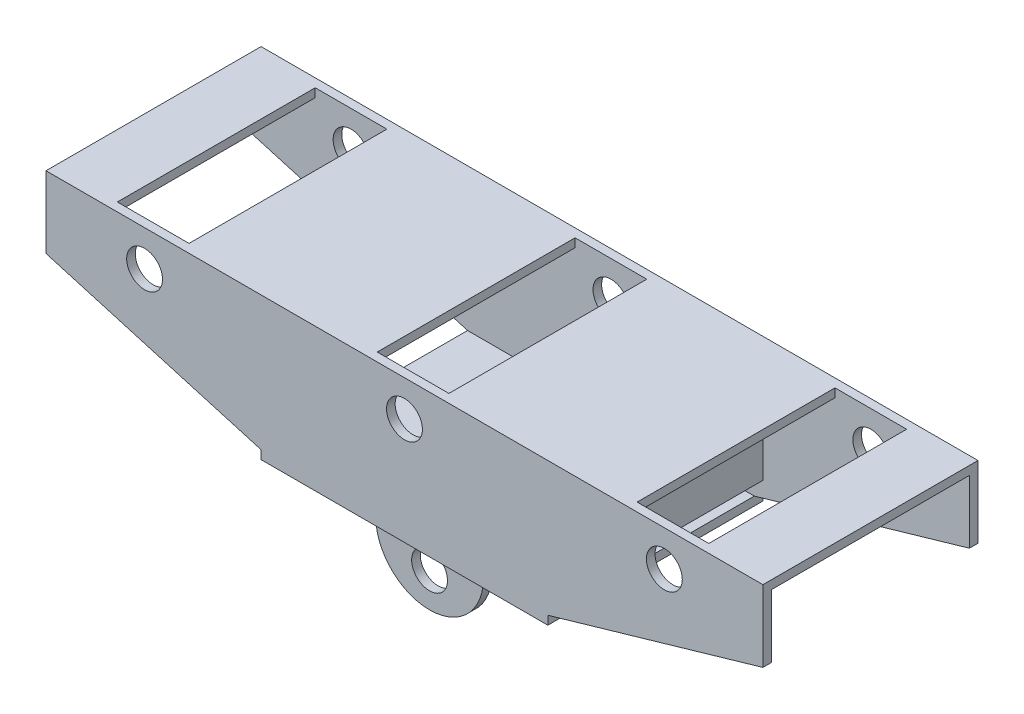
from build123d import *

# Parameters (mm, degrees)
EXTRUDE_1_DEPTH        = 276
EXTRUDE_1_2_DEPTH      = 276
EXTRUDE_2_DEPTH        = 12
PATTERN_LINEAR_1_COUNT = 2
PATTERN_LINEAR_1_PITCH = 288
SKETCH_3_W             = 276
SKETCH_3_H             = 12
EXTRUDE_3_DEPTH        = 1000
SKETCH_4_W             = 400
SKETCH_4_H             = 300
EXTRUDE_4_DEPTH        = 12
SKETCH_5_W             = 150
SKETCH_5_H             = 12
EXTRUDE_5_DEPTH        = 100
SKETCH_6_R             = 25
CUT_EXTRUDE_1_DEPTH    = 635.502955076
SKETCH_7_R             = 25
CUT_EXTRUDE_2_DEPTH    = 650.458235763
SKETCH_8_W             = 100
SKETCH_8_H             = 276
CUT_EXTRUDE_3_DEPTH    = 645.003105583


with BuildPart() as part:
    # 草图1 → 凸台-拉伸1 (new body)
    with BuildSketch(Plane.XY):
        Polygon((-300, 0), (-200, 0), (-200, -150), (-212, -150), (-212, -12), (-300, -12), align=None)
    extrude(amount=EXTRUDE_1_DEPTH)



with BuildPart() as body_2:
    # 草图1 → Extrude 1 2 (new body)
    with BuildSketch(Plane.XY):
        Polygon((300, 0), (200, 0), (200, -150), (212, -150), (212, -12), (300, -12), align=None)
    extrude(amount=EXTRUDE_1_2_DEPTH)


with BuildPart() as part_1:
    add(part.part)

    add(body_2.part)  # 凸台-拉伸2 merges body 2
    # 草图2 → 凸台-拉伸2 (add)
    with BuildSketch(Plane.XY.offset(276)):
        Polygon((-500, 12), (500, 12), (500, -88), (200, -175), (-200, -175), (-500, -88), align=None)
    extrude_2 = extrude(amount=EXTRUDE_2_DEPTH)

    # 阵列(线性)1: 凸台-拉伸2 ×2
    with Locations(*[(0, 0, -i * PATTERN_LINEAR_1_PITCH) for i in range(1, PATTERN_LINEAR_1_COUNT)]):
        add(extrude_2)

    # 草图3 → 凸台-拉伸3 (add)
    with BuildSketch(Plane(origin=(500, 0, 0), x_dir=(0, 0, -1), z_dir=(1, 0, 0))):
        with Locations((-138, 6)):
            Rectangle(SKETCH_3_W, SKETCH_3_H)
    extrude(amount=-EXTRUDE_3_DEPTH)

    # 草图4 → 凸台-拉伸4 (add)
    with BuildSketch(Plane.XZ.offset(175)):
        with Locations((0, 138)):
            Rectangle(SKETCH_4_W, SKETCH_4_H)
    extrude(amount=EXTRUDE_4_DEPTH)

    # 草图5 → 凸台-拉伸5 (add)
    with BuildSketch(Plane(origin=(0, -187, 0), x_dir=(-1, 0, 0), z_dir=(0, -1, 0))):
        with Locations((0, -247)):
            Rectangle(SKETCH_5_W, SKETCH_5_H)
        with Locations((0, -29)):
            Rectangle(SKETCH_5_W, SKETCH_5_H)
    extrude(amount=EXTRUDE_5_DEPTH)

    # 草图6 → 切除-拉伸1 (cut, through all)
    with BuildSketch(Plane.XY.offset(253)):
        with Locations((0, -238)):
            Circle(SKETCH_6_R)
        with BuildLine():
            Line((75, -211), (75, -287))
            Line((75, -287), (-75, -287))
            Line((-75, -287), (-75, -211))
            ThreePointArc((-75, -211), (0, -286), (75, -211))
        make_face()
    extrude(amount=-CUT_EXTRUDE_1_DEPTH, mode=Mode.SUBTRACT)

    # 草图7 → 切除-拉伸2 (cut, through all)
    with BuildSketch(Plane.XY.offset(288)):
        with Locations((-362.5, -38)):
            Circle(SKETCH_7_R)
        with Locations((362.5, -38)):
            Circle(SKETCH_7_R)
        with Locations((0, -38)):
            Circle(SKETCH_7_R)
    extrude(amount=-CUT_EXTRUDE_2_DEPTH, mode=Mode.SUBTRACT)

    # 草图8 → 切除-拉伸3 (cut, through all)
    with BuildSketch(Plane.XZ):
        with Locations((362.5, 138)):
            Rectangle(SKETCH_8_W, SKETCH_8_H)
        with Locations((-362.5, 138)):
            Rectangle(SKETCH_8_W, SKETCH_8_H)
        with Locations((0, 138)):
            Rectangle(SKETCH_8_W, SKETCH_8_H)
    extrude(amount=-CUT_EXTRUDE_3_DEPTH, mode=Mode.SUBTRACT)


solid = part_1.part
